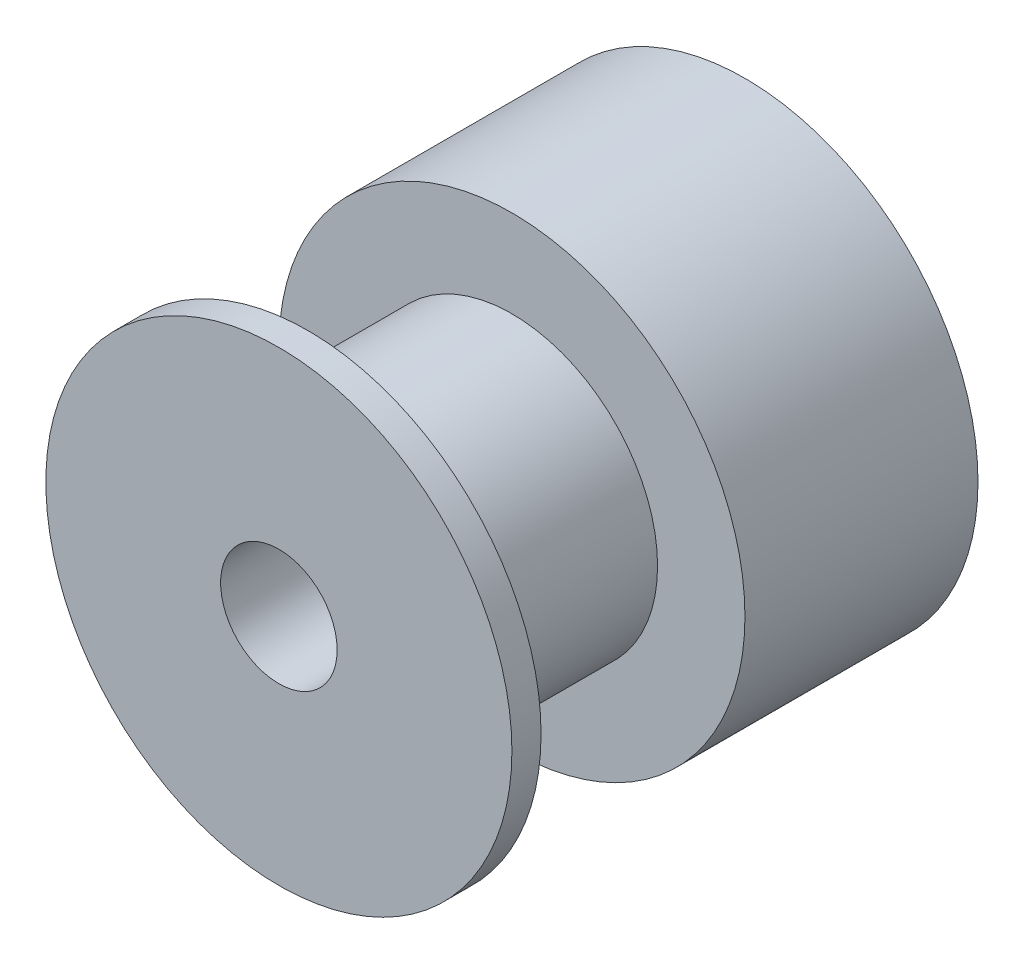
from build123d import *

# Parameters (mm, degrees)
SKETCH_1_R      = 8
SKETCH_1_R_2    = 2
EXTRUDE_1_DEPTH = 8
SKETCH_3_R      = 5
SKETCH_3_R_2    = 2
EXTRUDE_2_DEPTH = 7
SKETCH_4_R      = 8
SKETCH_4_R_2    = 2
EXTRUDE_3_DEPTH = 1


with BuildPart() as part:
    # 草图1 → 凸台-拉伸1 (new body)
    with BuildSketch(Plane.XY):
        Circle(SKETCH_1_R)
        Circle(SKETCH_1_R_2, mode=Mode.SUBTRACT)
    extrude(amount=EXTRUDE_1_DEPTH)

    # 草图3 → 凸台-拉伸2 (add)
    with BuildSketch(Plane.XY.offset(8)):
        Circle(SKETCH_3_R)
        Circle(SKETCH_3_R_2, mode=Mode.SUBTRACT)
    extrude(amount=EXTRUDE_2_DEPTH)

    # 草图4 → 凸台-拉伸3 (add)
    with BuildSketch(Plane.XY.offset(15)):
        Circle(SKETCH_4_R)
        Circle(SKETCH_4_R_2, mode=Mode.SUBTRACT)
    extrude(amount=EXTRUDE_3_DEPTH)


solid = part.part
